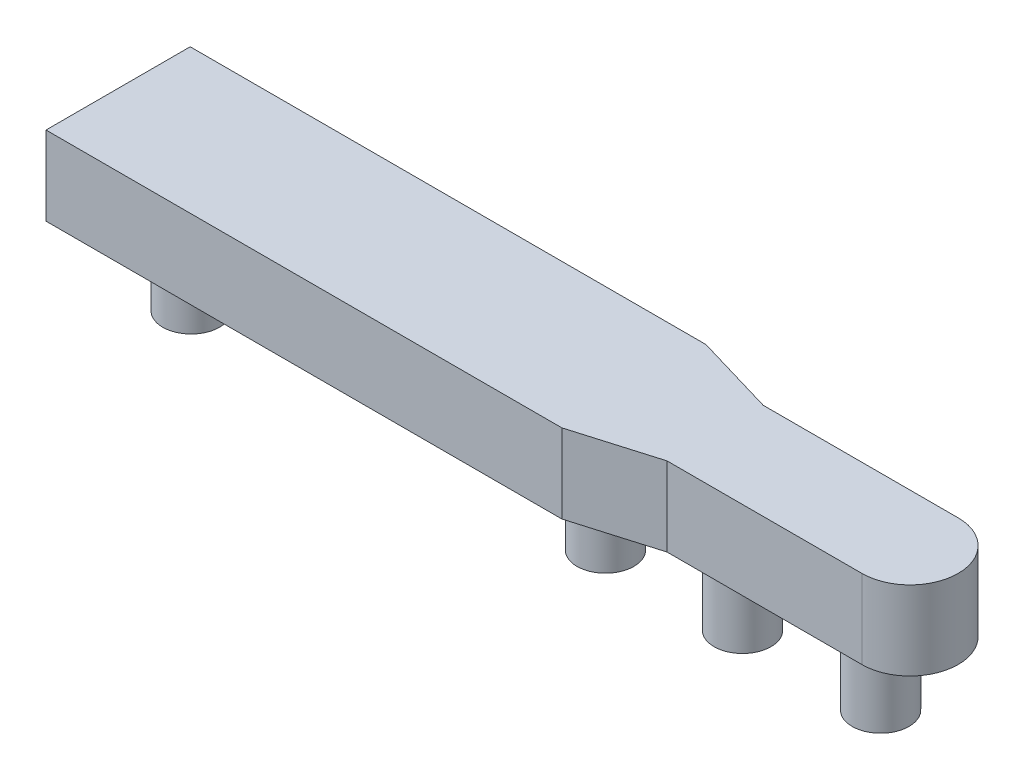
from build123d import *

# Parameters (mm, degrees)
SKETCH1_W           = 104
SKETCH1_H           = 9.72
BODY_DEPTH          = 17.75
FRONT_CUT_OUT_DEPTH = 89.865925518
SKETCH4_R           = 3.5
BOSS_EXTRUDE2_DEPTH = 9.5


with BuildPart() as part:
    # Sketch1 → body (new body)
    with BuildSketch(Plane.XY):
        with Locations((34.530987618, 4.261078665)):
            Rectangle(SKETCH1_W, SKETCH1_H)
    extrude(amount=BODY_DEPTH)

    # Sketch2 → front_cut_out (cut, through all)
    with BuildSketch(Plane.XZ.offset(0.598921335)):
        with BuildLine():
            Line((46.030987618, 17.75), (56.030987618, 14.8))
            Line((56.030987618, 14.8), (80.030987618, 14.8))
            ThreePointArc((80.030987618, 14.8), (85.955987618, 8.875), (80.030987618, 2.95))
            Line((80.030987618, 2.95), (56.030987618, 2.95))
            Line((56.030987618, 2.95), (46.030987618, 0))
            Line((46.030987618, 0), (86.530987618, 0))
            Line((86.530987618, 0), (86.530987618, 17.75))
            Line((86.530987618, 17.75), (46.030987618, 17.75))
        make_face()
    extrude(amount=-FRONT_CUT_OUT_DEPTH, mode=Mode.SUBTRACT)

    # Sketch4 → Boss-Extrude2 (add)
    with BuildSketch(Plane.XZ.offset(0.598921335)):
        with Locations(Location((-8.469012382, 8.875, 0), (0, 0, 180))):
            Circle(SKETCH4_R)
        with Locations(Location((42.530987618, 8.875, 0), (0, 0, 180))):
            Circle(SKETCH4_R)
        with Locations(Location((59.530872729, 9, 0), (0, 0, 180))):
            Circle(SKETCH4_R)
        with Locations(Location((76.530895707, 9, 0), (0, 0, 180))):
            Circle(SKETCH4_R)
    extrude(amount=BOSS_EXTRUDE2_DEPTH)


solid = part.part
